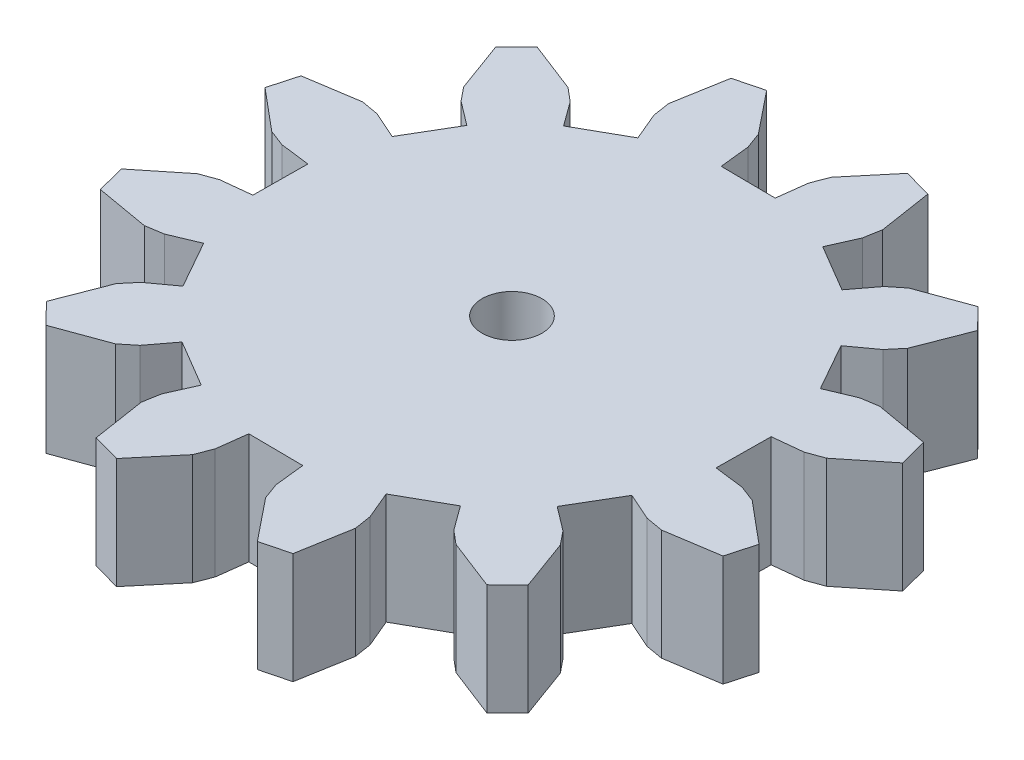
from build123d import *

# Parameters (mm, degrees)
SKETCH1_R           = 0.81
BOSS_EXTRUDE1_DEPTH = 3


with BuildPart() as part:
    # Sketch1 → Boss-Extrude1 (new body)
    with BuildSketch(Plane(origin=(0, 0, 0), x_dir=(1, 0, 0), z_dir=(0, 1, 0))):
        Polygon((5.6453129, 2.562826463), (6.3943589, 2.877662463), (6.8624159, 2.950894463), (8.3003709, 2.699622463), (8.4974959, 1.934301463), (7.3598559, 1.019628463), (6.9146609, 0.857633463), (6.1067249, 0.771435463), (6.0924239, -0.702085537), (6.8985319, -0.803957537), (7.3404979, -0.974570537), (8.4601699, -1.911153537), (8.2482219, -2.672493537), (6.8056559, -2.895801537), (6.3391139, -2.813510537), (5.5963139, -2.484188537), (4.8471689, -3.753135537), (5.4943549, -4.244415537), (5.7917899, -4.613151537), (6.2931629, -5.984095537), (5.7289469, -6.537468537), (4.3679989, -6.009575537), (4.0051049, -5.705026537), (3.5264829, -5.048435537), (2.2432229, -5.772805537), (2.5580589, -6.521851537), (2.6312909, -6.989908537), (2.3800189, -8.427863537), (1.6146979, -8.624988537), (0.7000259, -7.487348537), (0.5380299, -7.042153537), (0.4518319, -6.234217537), (-1.0216891, -6.219916537), (-1.1235611, -7.026024537), (-1.2941741, -7.467990537), (-2.2307561, -8.587662537), (-2.9920971, -8.375714537), (-3.2154051, -6.933148537), (-3.1331131, -6.466606537), (-2.8037921, -5.723806537), (-4.0727391, -4.974661537), (-4.5640191, -5.621847537), (-4.9327541, -5.919282537), (-6.3036991, -6.420655537), (-6.8570721, -5.856439537), (-6.3291791, -4.495491537), (-6.0246291, -4.132597537), (-5.3680391, -3.653975537), (-6.0924091, -2.370715537), (-6.8414551, -2.685551537), (-7.3095121, -2.758783537), (-8.7474671, -2.507511537), (-8.9445921, -1.742190537), (-7.8069511, -0.827518537), (-7.3617561, -0.665522537), (-6.5538201, -0.579324537), (-6.5395191, 0.894196463), (-7.3456281, 0.996068463), (-7.7875941, 1.166681463), (-8.9072661, 2.103264463), (-8.6953181, 2.864604463), (-7.2527521, 3.087912463), (-6.7862101, 3.005620463), (-6.0434091, 2.676299463), (-5.2942651, 3.945246463), (-5.9414511, 4.436526463), (-6.2388861, 4.805262463), (-6.7402581, 6.176206463), (-6.1760431, 6.729579463), (-4.8150951, 6.201686463), (-4.4522011, 5.897137463), (-3.9735791, 5.240546463), (-2.6903191, 5.964916463), (-3.0051541, 6.713962463), (-3.0783871, 7.182019463), (-2.8271151, 8.619974463), (-2.0617941, 8.817099463), (-1.1471211, 7.679458463), (-0.9851261, 7.234264463), (-0.8989281, 6.426327463), (0.5745929, 6.412026463), (0.6764649, 7.218135463), (0.8470779, 7.660101463), (1.7836609, 8.779773463), (2.5450009, 8.567825463), (2.7683089, 7.125259463), (2.6860179, 6.658717463), (2.3566959, 5.915916463), (3.6256429, 5.166772463), (4.1169229, 5.813958463), (4.4856589, 6.111393463), (5.8566029, 6.612765463), (6.4099759, 6.048550463), (5.8820829, 4.687602463), (5.5775339, 4.324708463), (4.9209439, 3.846086463), align=None)
        with Locations(Location((-0.2235476, 0.096055463, 0), (0, 0, 270))):
            Circle(SKETCH1_R, mode=Mode.SUBTRACT)
    extrude(amount=BOSS_EXTRUDE1_DEPTH)


solid = part.part
